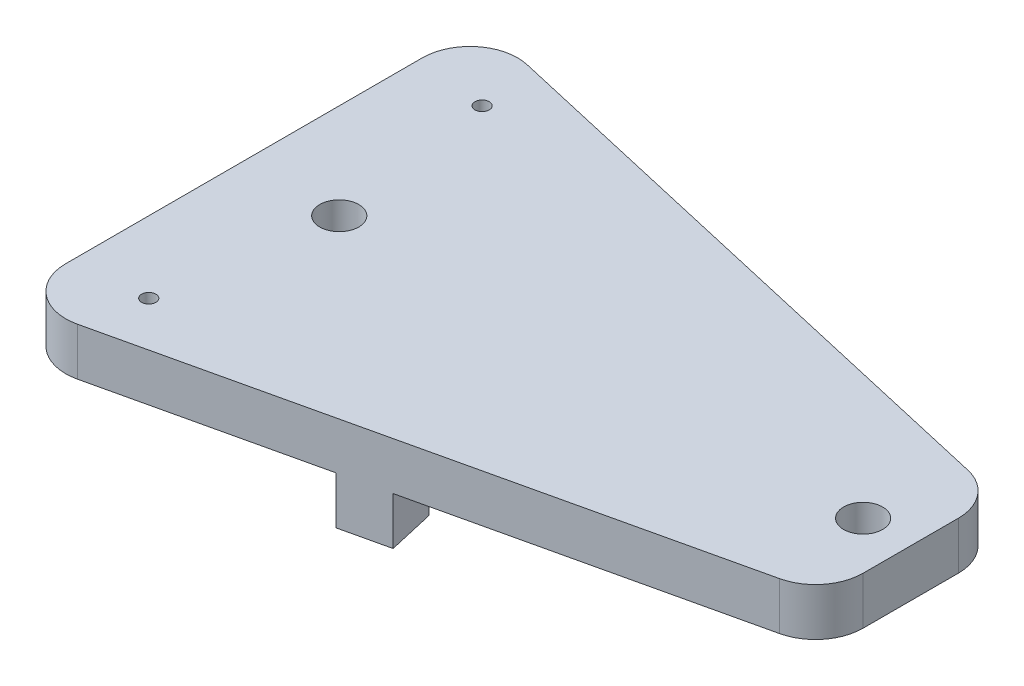
from build123d import *

# Parameters (mm, degrees)
SKETCH_1_R          = 4.1
SKETCH_1_R_2        = 1.5
EXTRUDE_1_DEPTH     = 10
SKETCH_2_W          = 10.2
SKETCH_2_H          = 10.2
CUT_EXTRUDE_1_DEPTH = 5
EXTRUDE_2_DEPTH     = 10


with BuildPart() as part:
    # ｽｹｯﾁ1 → ﾎﾞｽ - 押し出し1 (new body)
    with BuildSketch(Plane(origin=(0, 0, 0), x_dir=(1, 0, 0), z_dir=(0, 1, 0))):
        with BuildLine():
            Line((-90.755581693, -47.201953746), (29.244418307, -19.748139436))
            ThreePointArc((29.244418307, -19.748139436), (34.834131004, -16.232897902), (37.014221558, -10))
            Line((37.014221558, -10), (37.014221558, 10))
            ThreePointArc((37.014221558, 10), (34.834131004, 16.232897902), (29.244418307, 19.748139436))
            Line((29.244418307, 19.748139436), (-90.755581693, 47.201953746))
            ThreePointArc((-90.755581693, 47.201953746), (-99.218676344, 45.273723756), (-102.985778442, 37.45381431))
            Line((-102.985778442, 37.45381431), (-102.985778442, -37.45381431))
            ThreePointArc((-102.985778442, -37.45381431), (-99.218676344, -45.273723756), (-90.755581693, -47.201953746))
        make_face()
        with Locations(Location((-82.985778442, 0, 0), (0, 0, 270))):
            Circle(SKETCH_1_R, mode=Mode.SUBTRACT)
        with Locations(Location((27.014221558, 0, 0), (0, 0, 270))):
            Circle(SKETCH_1_R, mode=Mode.SUBTRACT)
        with Locations(Location((-87.985778442, 35, 0), (0, 0, 270))):
            Circle(SKETCH_1_R_2, mode=Mode.SUBTRACT)
        with Locations(Location((-87.985778442, -35, 0), (0, 0, 270))):
            Circle(SKETCH_1_R_2, mode=Mode.SUBTRACT)
    extrude(amount=EXTRUDE_1_DEPTH)

    # ｽｹｯﾁ2 → ｶｯﾄ - 押し出し1 (cut)
    with BuildSketch(Plane.XZ):
        with Locations((-87.985778442, 35)):
            Rectangle(SKETCH_2_W, SKETCH_2_H)
        with Locations((-87.985778442, -35)):
            Rectangle(SKETCH_2_W, SKETCH_2_H)
    extrude(amount=-CUT_EXTRUDE_1_DEPTH, mode=Mode.SUBTRACT)

    # ｽｹｯﾁ3 → ﾎﾞｽ - 押し出し2 (add)
    with BuildSketch(Plane.XZ):
        Polygon((-46.56667029, 37.092335677), (-36.818530855, 34.862138928), (-39.048727604, 25.113999492), (-48.79686704, 27.344196242), align=None)
        Polygon((-46.56667029, -37.092335677), (-36.818530855, -34.862138928), (-39.048727604, -25.113999492), (-48.79686704, -27.344196242), align=None)
    extrude(amount=EXTRUDE_2_DEPTH)


solid = part.part
